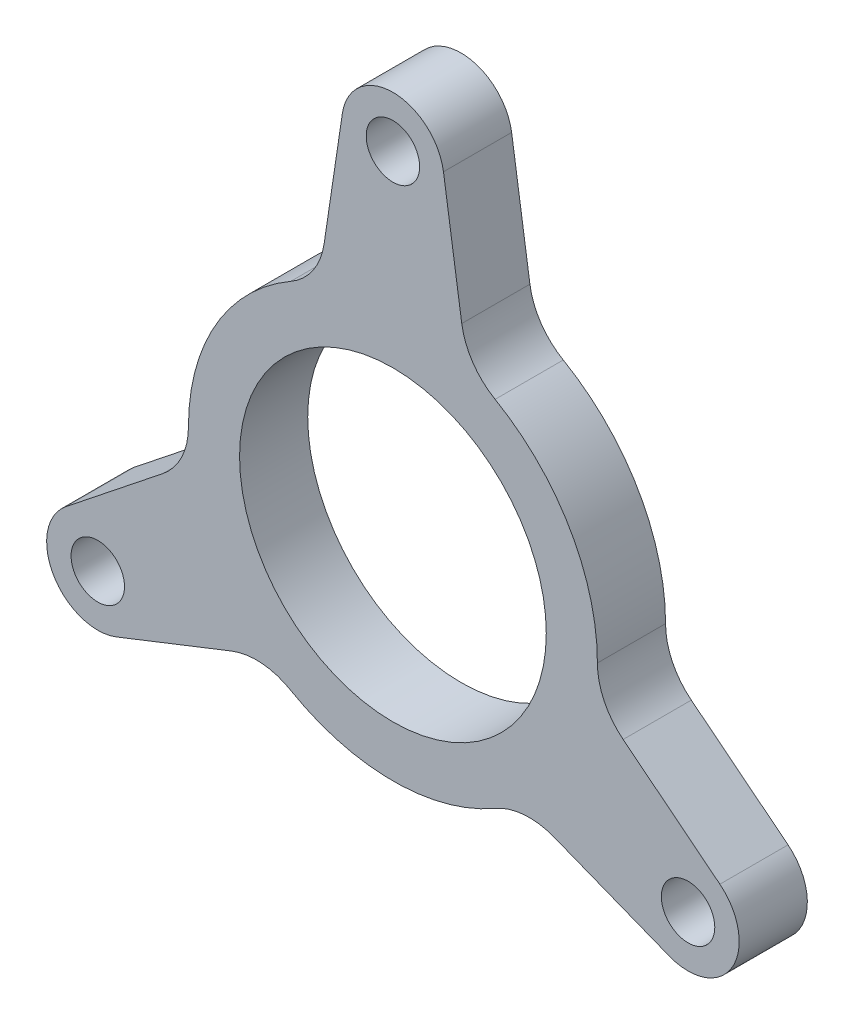
from build123d import *

# Parameters (mm, degrees)
SKETCH2_R           = 19.05
SKETCH2_R_2         = 14.2875
SKETCH2_R_3         = 4.7625
SKETCH2_R_4         = 2.4892
BOSS_EXTRUDE1_DEPTH = 6.35
FILLET2_R           = 6.35


with BuildPart() as part:
    # Sketch2 → Boss-Extrude1 (new body)
    # profile 1 of 10: a face of its own
    with BuildSketch(Plane.XY):
        Circle(SKETCH2_R)
        Circle(SKETCH2_R_2, mode=Mode.SUBTRACT)
    # profile 2 of 10: a face of its own
    with BuildSketch(Plane.XY):
        with BuildLine():
            Line((30.461032527, -12.147828653), (18.828728894, -2.89507655))
            ThreePointArc((18.828728894, -2.89507655), (16.497783942, -9.525), (11.921574285, -14.858619268))
            Line((11.921574285, -14.858619268), (25.750844478, -20.306113668))
            ThreePointArc((25.750844478, -20.306113668), (23.371860585, -13.49375), (30.461032527, -12.147828653))
        make_face()
    # profile 3 of 10: a face of its own
    with BuildSketch(Plane.XY):
        with BuildLine():
            ThreePointArc((4.7625, 31.75), (-0.352941685, 27.000595993), (-4.710188049, 32.453942321))
            Line((-4.710188049, 32.453942321), (-6.907154609, 17.753695818))
            ThreePointArc((-6.907154609, 17.753695818), (0, 19.05), (6.907154609, 17.753695818))
            Line((6.907154609, 17.753695818), (4.710188049, 32.453942321))
            ThreePointArc((4.710188049, 32.453942321), (4.749404007, 32.102941685), (4.7625, 31.75))
        make_face()
    # profile 4 of 10: a face of its own
    with BuildSketch(Plane.XY):
        with BuildLine():
            ThreePointArc((-11.921574285, -14.858619268), (-16.497783942, -9.525), (-18.828728894, -2.89507655))
            Line((-18.828728894, -2.89507655), (-30.461032527, -12.147828653))
            ThreePointArc((-30.461032527, -12.147828653), (-25.427261032, -11.585424635), (-22.73380657, -15.875))
            ThreePointArc((-22.73380657, -15.875), (-23.55967289, -18.555358468), (-25.750844478, -20.306113668))
            Line((-25.750844478, -20.306113668), (-11.921574285, -14.858619268))
        make_face()
    # profile 5 of 10: a face of its own
    with BuildSketch(Plane.XY):
        with Locations((-27.49630657, -15.875)):
            Circle(SKETCH2_R_3)
        with Locations((-27.49630657, -15.875)):
            Circle(SKETCH2_R_4, mode=Mode.SUBTRACT)
    # profile 6 of 10: a face of its own
    with BuildSketch(Plane.XY):
        with Locations((27.49630657, -15.875)):
            Circle(SKETCH2_R_3)
        with Locations((27.49630657, -15.875)):
            Circle(SKETCH2_R_4, mode=Mode.SUBTRACT)
    # profile 7 of 10: a face of its own
    with BuildSketch(Plane.XY):
        with Locations((0, 31.75)):
            Circle(SKETCH2_R_3)
        with Locations((0, 31.75)):
            Circle(SKETCH2_R_4, mode=Mode.SUBTRACT)
    # profile 8 of 10: a face of its own
    with BuildSketch(Plane.XY):
        with BuildLine():
            ThreePointArc((6.907154609, 17.753695818), (0, 19.05), (-6.907154609, 17.753695818))
            ThreePointArc((-6.907154609, 17.753695818), (-16.497783942, 9.525), (-18.828728894, -2.89507655))
            ThreePointArc((-18.828728894, -2.89507655), (-16.497783942, -9.525), (-11.921574285, -14.858619268))
            ThreePointArc((-11.921574285, -14.858619268), (0, -19.05), (11.921574285, -14.858619268))
            ThreePointArc((11.921574285, -14.858619268), (16.497783942, -9.525), (18.828728894, -2.89507655))
            ThreePointArc((18.828728894, -2.89507655), (18.994601673, -1.451760064), (19.05, 0))
            ThreePointArc((19.05, 0), (15.723927552, 10.754561932), (6.907154609, 17.753695818))
        make_face()
        Circle(SKETCH2_R_2, mode=Mode.SUBTRACT)
    # profile 9 of 10: a face of its own
    with BuildSketch(Plane.XY):
        with BuildLine():
            ThreePointArc((6.907154609, 17.753695818), (0, 19.05), (-6.907154609, 17.753695818))
            ThreePointArc((-6.907154609, 17.753695818), (-16.497783942, 9.525), (-18.828728894, -2.89507655))
            ThreePointArc((-18.828728894, -2.89507655), (-16.497783942, -9.525), (-11.921574285, -14.858619268))
            ThreePointArc((-11.921574285, -14.858619268), (0, -19.05), (11.921574285, -14.858619268))
            ThreePointArc((11.921574285, -14.858619268), (16.497783942, -9.525), (18.828728894, -2.89507655))
            ThreePointArc((18.828728894, -2.89507655), (18.994601673, -1.451760064), (19.05, 0))
            ThreePointArc((19.05, 0), (15.723927552, 10.754561932), (6.907154609, 17.753695818))
        make_face()
        Circle(SKETCH2_R_2, mode=Mode.SUBTRACT)
    # profile 10 of 10: a face of its own
    with BuildSketch(Plane.XY):
        with BuildLine():
            ThreePointArc((6.907154609, 17.753695818), (0, 19.05), (-6.907154609, 17.753695818))
            ThreePointArc((-6.907154609, 17.753695818), (-16.497783942, 9.525), (-18.828728894, -2.89507655))
            ThreePointArc((-18.828728894, -2.89507655), (-16.497783942, -9.525), (-11.921574285, -14.858619268))
            ThreePointArc((-11.921574285, -14.858619268), (0, -19.05), (11.921574285, -14.858619268))
            ThreePointArc((11.921574285, -14.858619268), (16.497783942, -9.525), (18.828728894, -2.89507655))
            ThreePointArc((18.828728894, -2.89507655), (18.994601673, -1.451760064), (19.05, 0))
            ThreePointArc((19.05, 0), (15.723927552, 10.754561932), (6.907154609, 17.753695818))
        make_face()
        Circle(SKETCH2_R_2, mode=Mode.SUBTRACT)
    extrude(amount=BOSS_EXTRUDE1_DEPTH)

    # Fillet2
    fillet2_edges = [part.edges().sort_by_distance(p)[0] for p in [
        (18.828728894, -2.89507655, 3.175),
        (11.921574285, -14.858619268, 3.175),
        (-11.921574285, -14.858619268, 3.175),
        (-18.828728894, -2.89507655, 3.175),
        (-6.907154609, 17.753695818, 3.175),
        (6.907154609, 17.753695818, 3.175),
    ]]
    fillet(fillet2_edges, radius=FILLET2_R)


solid = part.part
